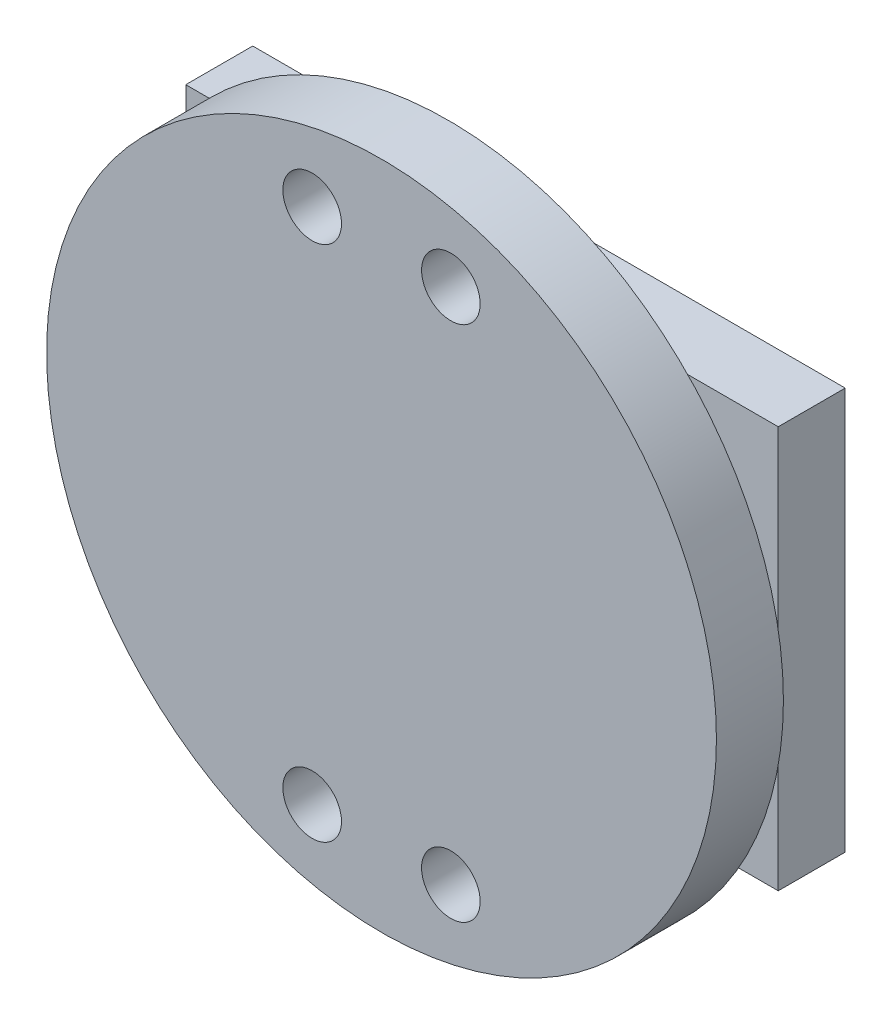
from build123d import *

# Parameters (mm, degrees)
SKETCH_1_W          = 35.38
SKETCH_1_H          = 24
EXTRUDE_1_DEPTH     = 4
SKETCH_2_R          = 10
EXTRUDE_2_DEPTH     = 2
SKETCH_3_R          = 20
EXTRUDE_3_DEPTH     = 4
SKETCH_4_R          = 1.75
CUT_EXTRUDE_1_DEPTH = 10


with BuildPart() as part:
    # 草图1 → 凸台-拉伸1 (new body)
    with BuildSketch(Plane.XY):
        with Locations((17.69, -12)):
            Rectangle(SKETCH_1_W, SKETCH_1_H)
    extrude(amount=EXTRUDE_1_DEPTH)

    # 草图2 → 凸台-拉伸2 (add)
    with BuildSketch(Plane.XY.offset(4)):
        with Locations((17.69, -12)):
            Circle(SKETCH_2_R)
    extrude(amount=EXTRUDE_2_DEPTH)

    # 草图3 → 凸台-拉伸3 (add)
    with BuildSketch(Plane.XY.offset(6)):
        with Locations((17.69, -12)):
            Circle(SKETCH_3_R)
    extrude(amount=EXTRUDE_3_DEPTH)

    # 草图4 → 切除-拉伸1 (cut)
    with BuildSketch(Plane(origin=(0, 0, 6), x_dir=(-1, 0, 0), z_dir=(0, 0, -1))):
        with Locations((-13.548895278, 3.454813221)):
            Circle(SKETCH_4_R)
        with Locations(Location((-21.831104722, 3.454813221, 0), (0, 0, 180))):
            Circle(SKETCH_4_R)
        with Locations(Location((-13.548895278, -27.454813221, 0), (0, 0, 180))):
            Circle(SKETCH_4_R)
        with Locations((-21.831104722, -27.454813221)):
            Circle(SKETCH_4_R)
    extrude(amount=-CUT_EXTRUDE_1_DEPTH, mode=Mode.SUBTRACT)


solid = part.part
